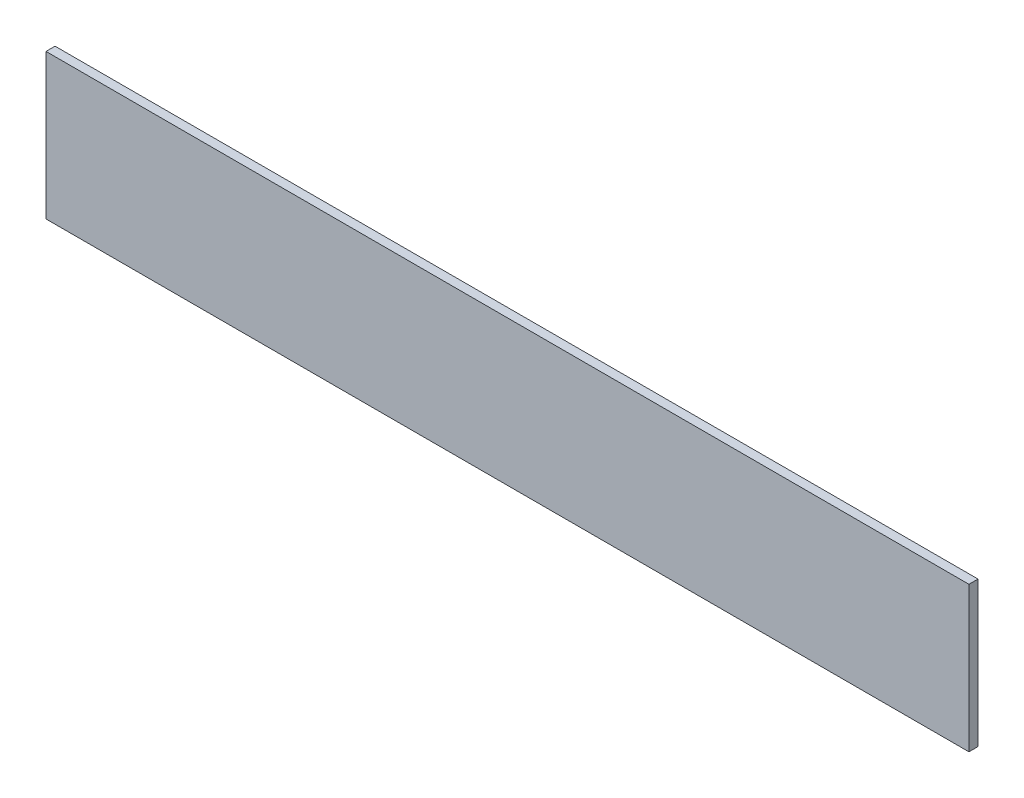
from build123d import *

# Parameters (mm, degrees)
SKETCH1_W           = 646.216251644
SKETCH1_H           = 101.6
BOSS_EXTRUDE1_DEPTH = 6.35


with BuildPart() as part:
    # Sketch1 → Boss-Extrude1 (new body)
    with BuildSketch(Plane.XY):
        with Locations((323.108125822, 50.8)):
            Rectangle(SKETCH1_W, SKETCH1_H)
    extrude(amount=BOSS_EXTRUDE1_DEPTH)


solid = part.part
